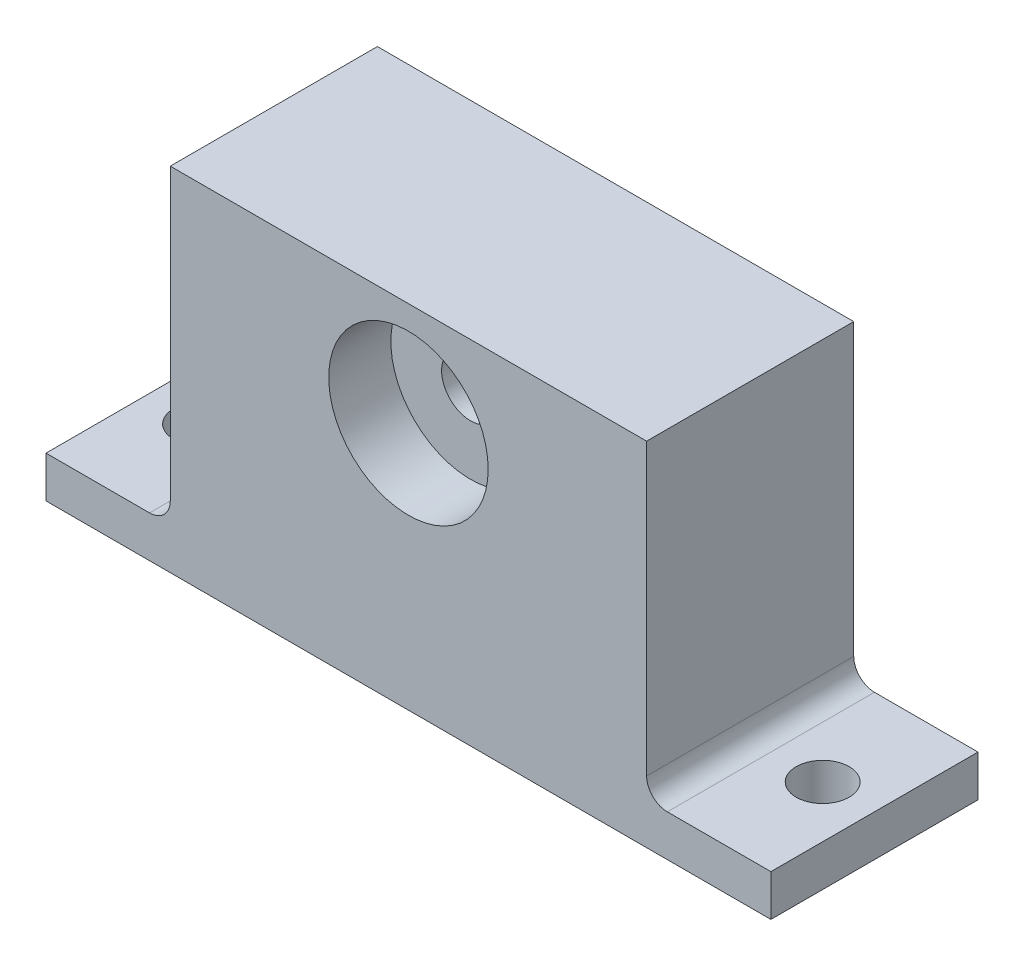
from build123d import *

# Parameters (mm, degrees)
SKETCH1_W           = 44.45
SKETCH1_H           = 21.59
BOSS_EXTRUDE1_DEPTH = 12.7
SKETCH2_W           = 7.62
SKETCH2_H           = 19.05
CUT_EXTRUDE1_DEPTH  = 12.7
FILLET1_R           = 1.27
FILLET2_R           = 1.27
SKETCH4_R           = 1.6256
CUT_EXTRUDE3_DEPTH  = 12.7
SKETCH5_R           = 1.778
CUT_EXTRUDE4_DEPTH  = 12.7
SKETCH6_R           = 4.8895
CUT_EXTRUDE5_DEPTH  = 3.81


with BuildPart() as part:
    # Sketch1 → Boss-Extrude1 (new body)
    with BuildSketch(Plane.XY):
        Rectangle(SKETCH1_W, SKETCH1_H)
    extrude(amount=BOSS_EXTRUDE1_DEPTH)

    # Sketch2 → Cut-Extrude1 (cut)
    with BuildSketch(Plane.XY.offset(12.7)):
        with Locations((-18.415, 1.27)):
            Rectangle(SKETCH2_W, SKETCH2_H)
        with Locations((18.415, 1.27)):
            Rectangle(SKETCH2_W, SKETCH2_H)
    extrude(amount=-CUT_EXTRUDE1_DEPTH, mode=Mode.SUBTRACT)

    # Fillet1
    fillet1_edges = [part.edges().sort_by_distance(p)[0] for p in [
        (-14.605, -8.255, 6.35),
    ]]
    fillet(fillet1_edges, radius=FILLET1_R)

    # Fillet2
    fillet2_edges = [part.edges().sort_by_distance(p)[0] for p in [
        (14.605, -8.255, 6.35),
    ]]
    fillet(fillet2_edges, radius=FILLET2_R)

    # Sketch4 → Cut-Extrude3 (cut)
    with BuildSketch(Plane(origin=(0, -8.255, 0), x_dir=(1, 0, 0), z_dir=(0, 1, 0))):
        with Locations(Location((19.05, -6.35, 0), (0, 0, 180))):
            Circle(SKETCH4_R)
        with Locations(Location((-19.05, -6.4262, 0), (0, 0, 180))):
            Circle(SKETCH4_R)
    extrude(amount=-CUT_EXTRUDE3_DEPTH, mode=Mode.SUBTRACT)

    # Sketch5 → Cut-Extrude4 (cut)
    with BuildSketch(Plane(origin=(0, 0, 0), x_dir=(-1, 0, 0), z_dir=(0, 0, -1))):
        with Locations((0, 4.445)):
            Circle(SKETCH5_R)
    extrude(amount=-CUT_EXTRUDE4_DEPTH, mode=Mode.SUBTRACT)

    # Sketch6 → Cut-Extrude5 (cut)
    with BuildSketch(Plane.XY.offset(12.7)):
        with Locations((0, 4.445)):
            Circle(SKETCH6_R)
    extrude(amount=-CUT_EXTRUDE5_DEPTH, mode=Mode.SUBTRACT)


solid = part.part
